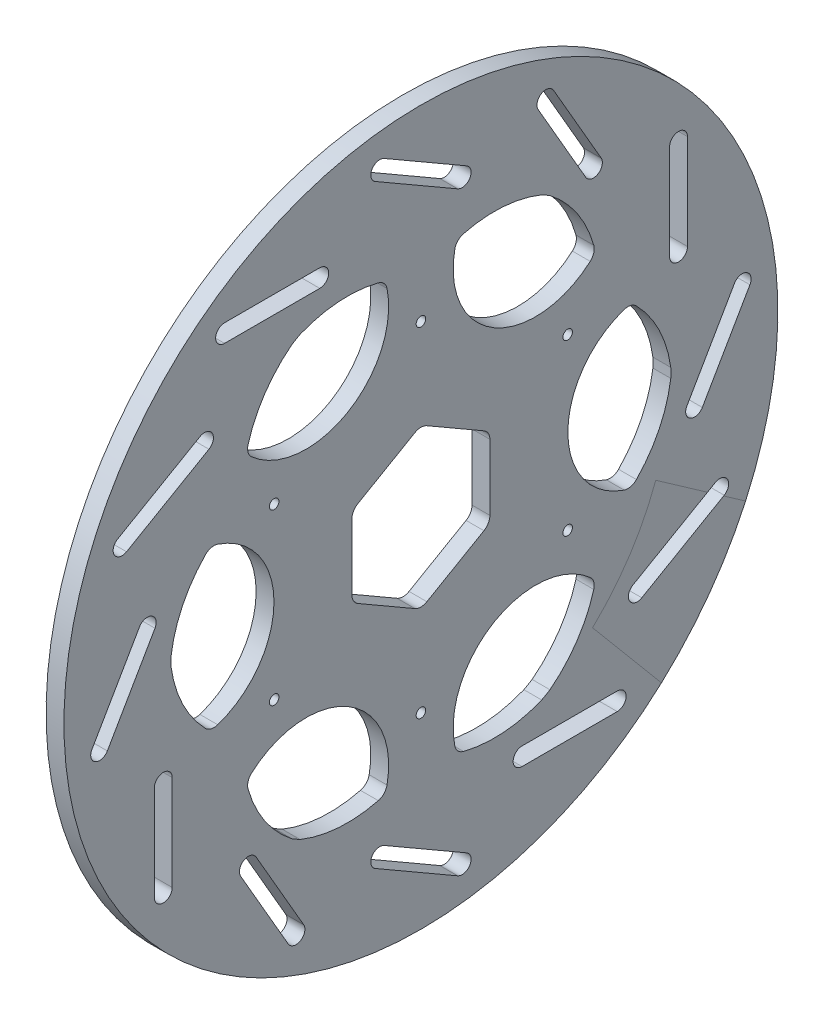
from build123d import *

# Parameters (mm, degrees)
SKETCH1_R           = 95.25
SKETCH1_R_2         = 66.675
MAIN_ROTOR_DEPTH    = 4.7625
CUT_SLOTS_DEPTH     = 135.788005424
BOSS_EXTRUDE2_START = -4.7625
BOSS_EXTRUDE2_DEPTH = 4.7625
FILLET1_R           = 3.175
FILLET2_R           = 3.175
SKETCH4_R           = 1.27
CUT_EXTRUDE2_DEPTH  = 135.788005569


with BuildPart() as part:
    # Sketch1 → Main Rotor (new body)
    with BuildSketch(Plane(origin=(0, 0, 0), x_dir=(0, 0, -1), z_dir=(1, 0, 0))):
        with Locations(Location((0, 0, 0), (0, 0, 180))):
            Circle(SKETCH1_R)
        with Locations(Location((0, 0, 0), (0, 0, 180))):
            Circle(SKETCH1_R_2, mode=Mode.SUBTRACT)
    extrude(amount=MAIN_ROTOR_DEPTH)

    # Sketch2 → Cut Slots (cut, through all)
    with BuildSketch(Plane(origin=(4.7625, 0, 0), x_dir=(0, 0, -1), z_dir=(1, 0, 0))):
        with BuildLine():
            Line((-87.787222993, -9.807897628), (-75.087222993, 12.189147628))
            ThreePointArc((-75.087222993, 12.189147628), (-71.834375, 13.060745621), (-70.962777007, 9.807897628))
            Line((-70.962777007, 9.807897628), (-83.662777007, -12.189147628))
            ThreePointArc((-83.662777007, -12.189147628), (-86.915625, -13.060745621), (-87.787222993, -9.807897628))
        make_face()
        with BuildLine():
            Line((-80.929914053, 35.399722993), (-58.932868797, 48.099722993))
            ThreePointArc((-58.932868797, 48.099722993), (-55.680020805, 47.228125), (-56.551618797, 43.975277007))
            Line((-56.551618797, 43.975277007), (-78.548664053, 31.275277007))
            ThreePointArc((-78.548664053, 31.275277007), (-81.801512046, 32.146875), (-80.929914053, 35.399722993))
        make_face()
        with BuildLine():
            Line((-52.3875, 71.122016425), (-26.9875, 71.122016425))
            ThreePointArc((-26.9875, 71.122016425), (-24.60625, 68.740766425), (-26.9875, 66.359516425))
            Line((-26.9875, 66.359516425), (-52.3875, 66.359516425))
            ThreePointArc((-52.3875, 66.359516425), (-54.76875, 68.740766425), (-52.3875, 71.122016425))
        make_face()
        with BuildLine():
            Line((-9.807897628, 87.787222993), (12.189147628, 75.087222993))
            ThreePointArc((12.189147628, 75.087222993), (13.060745621, 71.834375), (9.807897628, 70.962777007))
            Line((9.807897628, 70.962777007), (-12.189147628, 83.662777007))
            ThreePointArc((-12.189147628, 83.662777007), (-13.060745621, 86.915625), (-9.807897628, 87.787222993))
        make_face()
        with BuildLine():
            Line((35.399722993, 80.929914053), (48.099722993, 58.932868797))
            ThreePointArc((48.099722993, 58.932868797), (47.228125, 55.680020805), (43.975277007, 56.551618797))
            Line((43.975277007, 56.551618797), (31.275277007, 78.548664053))
            ThreePointArc((31.275277007, 78.548664053), (32.146875, 81.801512046), (35.399722993, 80.929914053))
        make_face()
        with BuildLine():
            Line((71.122016425, 52.3875), (71.122016425, 26.9875))
            ThreePointArc((71.122016425, 26.9875), (68.740766425, 24.60625), (66.359516425, 26.9875))
            Line((66.359516425, 26.9875), (66.359516425, 52.3875))
            ThreePointArc((66.359516425, 52.3875), (68.740766425, 54.76875), (71.122016425, 52.3875))
        make_face()
        with BuildLine():
            Line((87.787222993, 9.807897628), (75.087222993, -12.189147628))
            ThreePointArc((75.087222993, -12.189147628), (71.834375, -13.060745621), (70.962777007, -9.807897628))
            Line((70.962777007, -9.807897628), (83.662777007, 12.189147628))
            ThreePointArc((83.662777007, 12.189147628), (86.915625, 13.060745621), (87.787222993, 9.807897628))
        make_face()
        with BuildLine():
            Line((80.929914053, -35.399722993), (58.932868797, -48.099722993))
            ThreePointArc((58.932868797, -48.099722993), (55.680020805, -47.228125), (56.551618797, -43.975277007))
            Line((56.551618797, -43.975277007), (78.548664053, -31.275277007))
            ThreePointArc((78.548664053, -31.275277007), (81.801512046, -32.146875), (80.929914053, -35.399722993))
        make_face()
        with BuildLine():
            Line((52.3875, -71.122016425), (26.9875, -71.122016425))
            ThreePointArc((26.9875, -71.122016425), (24.60625, -68.740766425), (26.9875, -66.359516425))
            Line((26.9875, -66.359516425), (52.3875, -66.359516425))
            ThreePointArc((52.3875, -66.359516425), (54.76875, -68.740766425), (52.3875, -71.122016425))
        make_face()
        with BuildLine():
            Line((9.807897628, -87.787222993), (-12.189147628, -75.087222993))
            ThreePointArc((-12.189147628, -75.087222993), (-13.060745621, -71.834375), (-9.807897628, -70.962777007))
            Line((-9.807897628, -70.962777007), (12.189147628, -83.662777007))
            ThreePointArc((12.189147628, -83.662777007), (13.060745621, -86.915625), (9.807897628, -87.787222993))
        make_face()
        with BuildLine():
            Line((-35.399722993, -80.929914053), (-48.099722993, -58.932868797))
            ThreePointArc((-48.099722993, -58.932868797), (-47.228125, -55.680020805), (-43.975277007, -56.551618797))
            Line((-43.975277007, -56.551618797), (-31.275277007, -78.548664053))
            ThreePointArc((-31.275277007, -78.548664053), (-32.146875, -81.801512046), (-35.399722993, -80.929914053))
        make_face()
        with BuildLine():
            Line((-71.122016425, -52.3875), (-71.122016425, -26.9875))
            ThreePointArc((-71.122016425, -26.9875), (-68.740766425, -24.60625), (-66.359516425, -26.9875))
            Line((-66.359516425, -26.9875), (-66.359516425, -52.3875))
            ThreePointArc((-66.359516425, -52.3875), (-68.740766425, -54.76875), (-71.122016425, -52.3875))
        make_face()
    extrude(amount=-CUT_SLOTS_DEPTH, mode=Mode.SUBTRACT)

    # Sketch3 → Boss-Extrude2 (add)
    with BuildSketch(Plane(origin=(4.7625, 0, 0), x_dir=(0, 0, -1), z_dir=(1, 0, 0)).offset(BOSS_EXTRUDE2_START)):
        with BuildLine():
            ThreePointArc((-9.525, -59.299387197), (-20.960221835, -60.827644463), (-32.23159957, -58.366768064))
            ThreePointArc((-32.23159957, -58.366768064), (0, -66.675), (32.23159957, -58.366768064))
            ThreePointArc((32.23159957, -58.366768064), (20.960221835, -60.827644463), (9.525, -59.299387197))
            ThreePointArc((9.525, -59.299387197), (10.160495776, -44.87527558), (19.60245, -33.952439353))
            ThreePointArc((19.60245, -33.952439353), (33.782880766, -31.236885247), (46.592275742, -37.89858557))
            ThreePointArc((46.592275742, -37.89858557), (42.198174439, -48.565906809), (34.431304095, -57.096768064))
            ThreePointArc((34.431304095, -57.096768064), (57.742243797, -33.3375), (66.662903665, -1.27))
            ThreePointArc((66.662903665, -1.27), (63.158396274, -12.261737653), (56.117275742, -21.400801627))
            ThreePointArc((56.117275742, -21.400801627), (43.943376542, -13.638390333), (39.2049, 0))
            ThreePointArc((39.2049, 0), (43.943376542, 13.638390333), (56.117275742, 21.400801627))
            ThreePointArc((56.117275742, 21.400801627), (63.158396274, 12.261737653), (66.662903665, 1.27))
            ThreePointArc((66.662903665, 1.27), (57.742243797, 33.3375), (34.431304095, 57.096768064))
            ThreePointArc((34.431304095, 57.096768064), (42.198174439, 48.565906809), (46.592275742, 37.89858557))
            ThreePointArc((46.592275742, 37.89858557), (33.782880766, 31.236885247), (19.60245, 33.952439353))
            ThreePointArc((19.60245, 33.952439353), (10.160495776, 44.87527558), (9.525, 59.299387197))
            ThreePointArc((9.525, 59.299387197), (20.960221835, 60.827644463), (32.23159957, 58.366768064))
            ThreePointArc((32.23159957, 58.366768064), (0, 66.675), (-32.23159957, 58.366768064))
            ThreePointArc((-32.23159957, 58.366768064), (-20.960221835, 60.827644463), (-9.525, 59.299387197))
            ThreePointArc((-9.525, 59.299387197), (-10.160495776, 44.87527558), (-19.60245, 33.952439353))
            ThreePointArc((-19.60245, 33.952439353), (-33.782880766, 31.236885247), (-46.592275742, 37.89858557))
            ThreePointArc((-46.592275742, 37.89858557), (-42.198174439, 48.565906809), (-34.431304095, 57.096768064))
            ThreePointArc((-34.431304095, 57.096768064), (-57.742243797, 33.3375), (-66.662903665, 1.27))
            ThreePointArc((-66.662903665, 1.27), (-63.158396274, 12.261737653), (-56.117275742, 21.400801627))
            ThreePointArc((-56.117275742, 21.400801627), (-43.943376542, 13.638390333), (-39.2049, 0))
            ThreePointArc((-39.2049, 0), (-43.943376542, -13.638390333), (-56.117275742, -21.400801627))
            ThreePointArc((-56.117275742, -21.400801627), (-63.158396274, -12.261737653), (-66.662903665, -1.27))
            ThreePointArc((-66.662903665, -1.27), (-57.742243797, -33.3375), (-34.431304095, -57.096768064))
            ThreePointArc((-34.431304095, -57.096768064), (-42.198174439, -48.565906809), (-46.592275742, -37.89858557))
            ThreePointArc((-46.592275742, -37.89858557), (-33.782880766, -31.236885247), (-19.60245, -33.952439353))
            ThreePointArc((-19.60245, -33.952439353), (-10.160495776, -44.87527558), (-9.525, -59.299387197))
        make_face()
        Polygon((0, 21.249145717), (-18.4023, 10.624572859), (-18.4023, -10.624572859), (0, -21.249145717), (18.4023, -10.624572859), (18.4023, 10.624572859), align=None, mode=Mode.SUBTRACT)
    extrude(amount=BOSS_EXTRUDE2_DEPTH)

    # Fillet1
    fillet1_edges = [part.edges().sort_by_distance(p)[0] for p in [
        (2.38125, 21.249145717, 0),
        (2.38125, 10.624572859, 18.4023),
        (2.38125, -10.624572859, 18.4023),
        (2.38125, -21.249145717, 0),
        (2.38125, -10.624572859, -18.4023),
        (2.38125, 10.624572859, -18.4023),
    ]]
    fillet(fillet1_edges, radius=FILLET1_R)

    # Fillet2
    fillet2_edges = [part.edges().sort_by_distance(p)[0] for p in [
        (2.38125, -59.299387197, 9.525),
        (2.38125, -59.299387197, -9.525),
        (2.38125, -37.89858557, -46.592275742),
        (2.38125, -21.400801627, -56.117275742),
        (2.38125, 21.400801627, -56.117275742),
        (2.38125, 37.89858557, -46.592275742),
        (2.38125, 59.299387197, -9.525),
        (2.38125, 59.299387197, 9.525),
        (2.38125, 37.89858557, 46.592275742),
        (2.38125, 21.400801627, 56.117275742),
        (2.38125, -21.400801627, 56.117275742),
        (2.38125, -37.89858557, 46.592275742),
    ]]
    fillet(fillet2_edges, radius=FILLET2_R)

    # Sketch4 → Cut-Extrude2 (cut, through all)
    with BuildSketch(Plane.ZY):
        with Locations((0, 45.212)):
            Circle(SKETCH4_R)
        with Locations((39.154740556, 22.606)):
            Circle(SKETCH4_R)
        with Locations((39.154740556, -22.606)):
            Circle(SKETCH4_R)
        with Locations((0, -45.212)):
            Circle(SKETCH4_R)
        with Locations((-39.154740556, -22.606)):
            Circle(SKETCH4_R)
        with Locations((-39.154740556, 22.606)):
            Circle(SKETCH4_R)
    extrude(amount=-CUT_EXTRUDE2_DEPTH, mode=Mode.SUBTRACT)


solid = part.part
